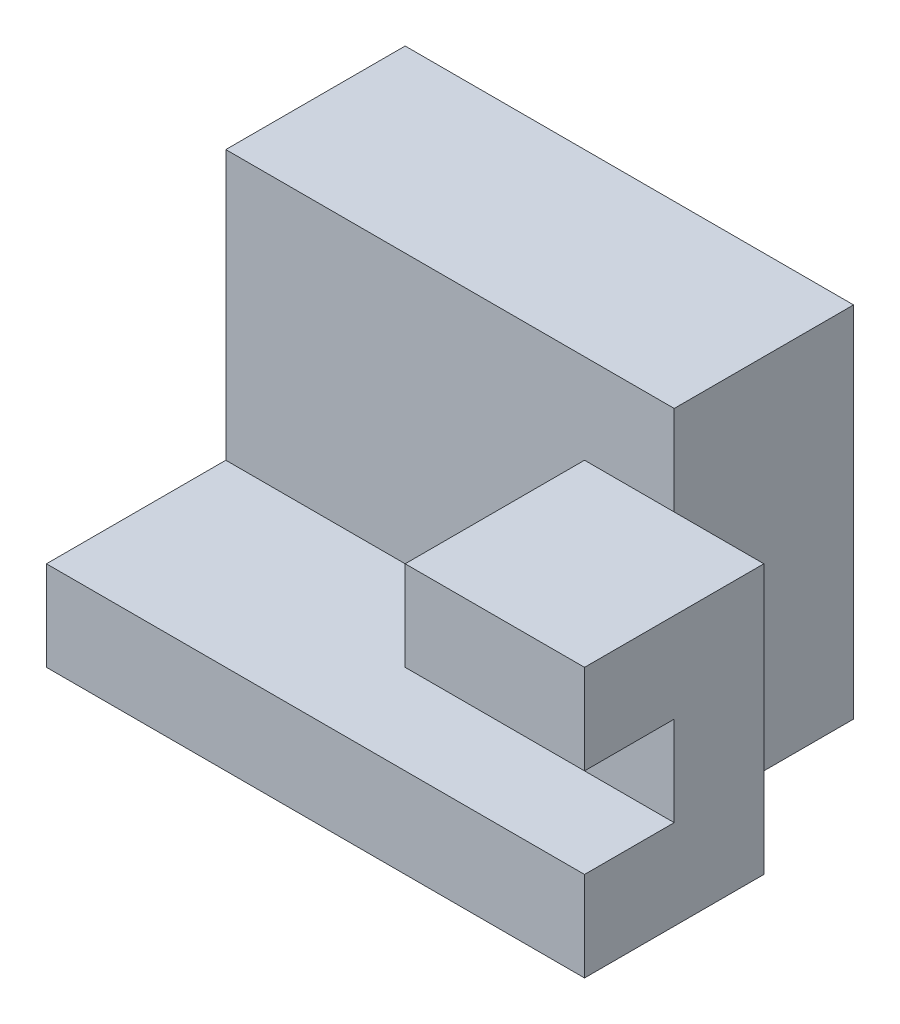
from build123d import *

# Parameters (mm, degrees)
BOSS_EXTRUDE1_DEPTH = 50
BOSS_EXTRUDE2_DEPTH = 10


with BuildPart() as part:
    # Sketch1 → Boss-Extrude1 (new body)
    with BuildSketch(Plane(origin=(0, 0, 0), x_dir=(0, 0, -1), z_dir=(1, 0, 0))):
        Polygon((20, 40), (20, 10), (0, 10), (0, 0), (40, 0), (40, 40), align=None)
    extrude(amount=-BOSS_EXTRUDE1_DEPTH)

    # Sketch1<3> → Boss-Extrude2 (add, symmetric)
    with BuildSketch(Plane(origin=(0, 0, 0), x_dir=(0, 0, -1), z_dir=(1, 0, 0))):
        Polygon((20, 30), (0, 30), (0, 20), (10, 20), (10, 10), (0, 10), (0, 0), (20, 0), align=None)
    extrude(amount=BOSS_EXTRUDE2_DEPTH, both=True)


solid = part.part
